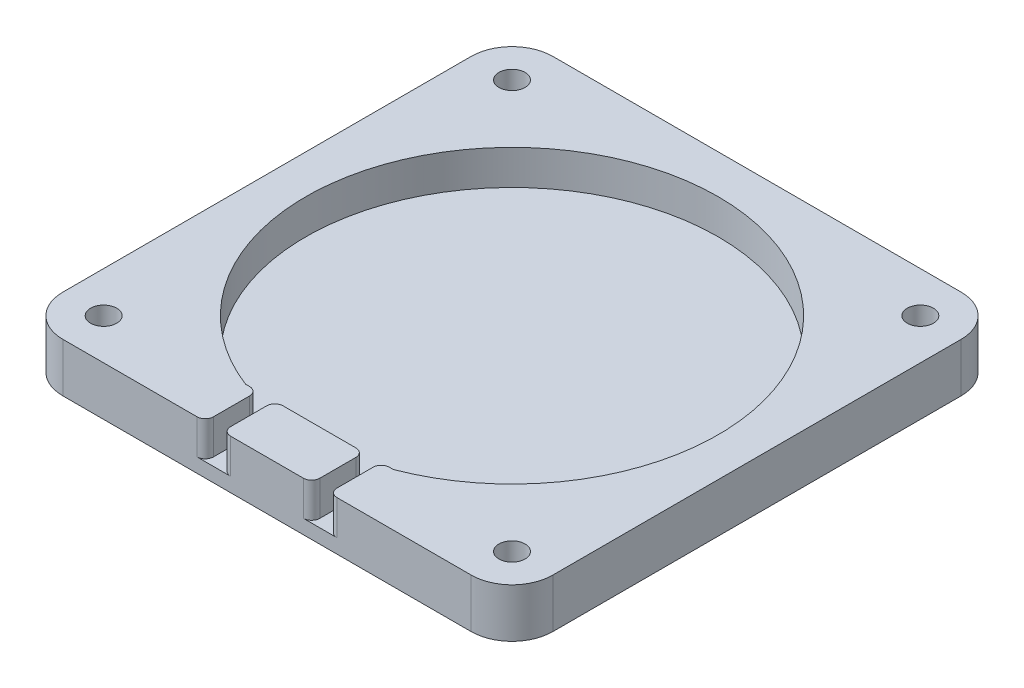
from build123d import *

# Parameters (mm, degrees)
SKETCH1_W            = 60
SKETCH1_H            = 60
BOSS_EXTRUDE1_DEPTH  = 4.2575
SKETCH2_W            = 60
SKETCH2_H            = 60
BOSS_EXTRUDE2_DEPTH  = 1.7425
SKETCH3_W            = 2.095743483
SKETCH3_H            = 23.459092757
CUT_EXTRUDE1_DEPTH   = 4.2575
FILLET1_R            = 1
FILLET2_R            = 5
M3_CLEARANCE_HOLE1_D = 3.2


with BuildPart() as part:
    # Sketch1 → Boss-Extrude1 (new body)
    with BuildSketch(Plane(origin=(0, 0, 0), x_dir=(1, 0, 0), z_dir=(0, 1, 0))):
        Rectangle(SKETCH1_W, SKETCH1_H)
        with BuildLine():
            Line((-9.04644108, -23.573807579), (9.04644108, -23.573807579))
            ThreePointArc((9.04644108, -23.573807579), (14.716185301, 20.518196562), (-25.229791914, 1.01))
            ThreePointArc((-25.229791914, 1.01), (-21.090422846, -13.883679778), (-9.04644108, -23.573807579))
        make_face(mode=Mode.SUBTRACT)
    extrude(amount=BOSS_EXTRUDE1_DEPTH)

    # Sketch2 → Boss-Extrude2 (add)
    with BuildSketch(Plane.XZ):
        Rectangle(SKETCH2_W, SKETCH2_H)
    extrude(amount=BOSS_EXTRUDE2_DEPTH)

    # Sketch3 → Cut-Extrude1 (cut)
    with BuildSketch(Plane(origin=(0, 4.2575, 0), x_dir=(1, 0, 0), z_dir=(0, 1, 0))):
        with Locations((-6.512128259, -34.72527871)):
            Rectangle(SKETCH3_W, SKETCH3_H)
        with Locations((6.512128259, -34.72527871)):
            Rectangle(SKETCH3_W, SKETCH3_H)
    extrude(amount=-CUT_EXTRUDE1_DEPTH, mode=Mode.SUBTRACT)

    # Fillet1
    fillet1_edges = [part.edges().sort_by_distance(p)[0] for p in [
        (-5.464256517, 2.12875, 30),
        (-5.464256517, 2.12875, 23.573807579),
        (-7.56, 2.12875, 30),
        (-7.56, 2.12875, 23.573807579),
        (5.464256517, 2.12875, 30),
        (5.464256517, 2.12875, 23.573807579),
        (7.56, 2.12875, 30),
        (7.56, 2.12875, 23.573807579),
    ]]
    fillet(fillet1_edges, radius=FILLET1_R)

    # Fillet2
    fillet2_edges = [part.edges().sort_by_distance(p)[0] for p in [
        (30, 1.2575, 30),
        (-30, 1.2575, 30),
        (-30, 1.2575, -30),
        (30, 1.2575, -30),
    ]]
    fillet(fillet2_edges, radius=FILLET2_R)

    # M3 Clearance Hole1 (through all)
    with Locations(Plane(origin=(0, -1.7425, 0), x_dir=(-1, 0, 0), z_dir=(0, -1, 0))):
        with Locations((-25, 25), (25, 25), (25, -25), (-25, -25)):
            Hole(M3_CLEARANCE_HOLE1_D / 2)


solid = part.part
